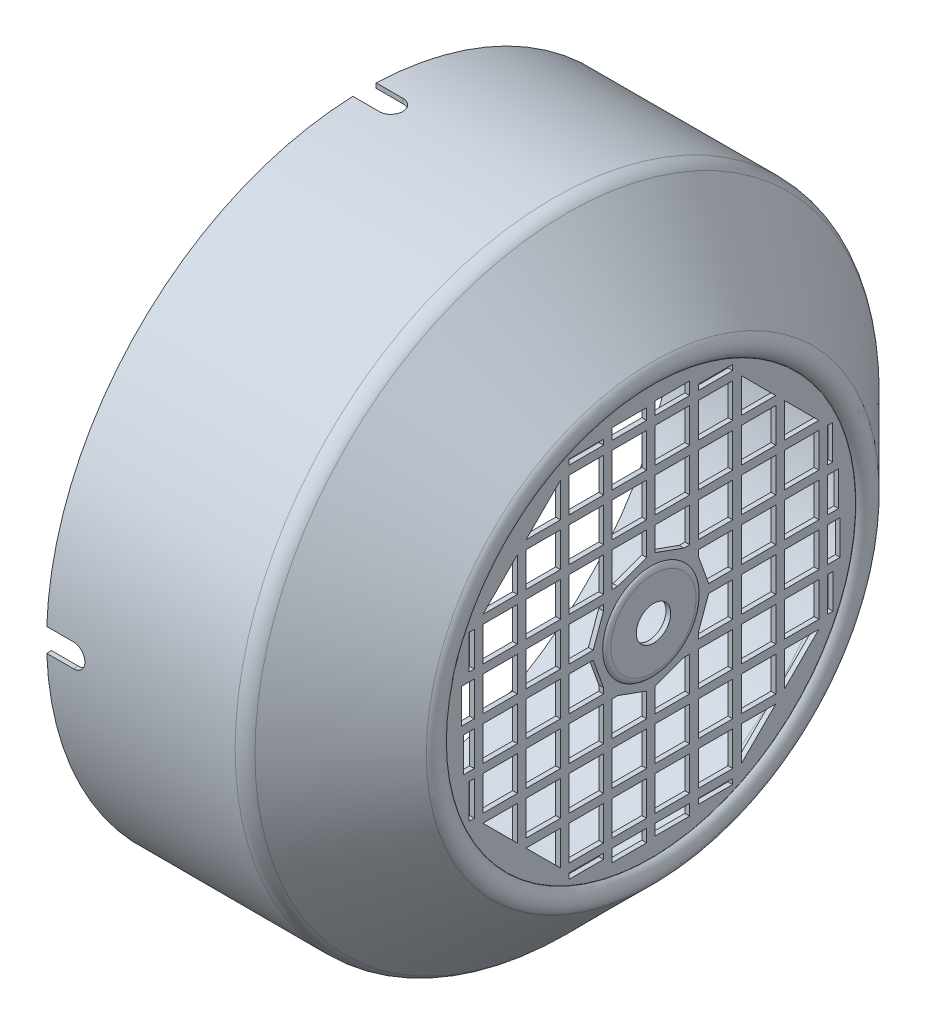
from build123d import *

# Parameters (mm, degrees)
ESQUISSE2_W                  = 8
ESQUISSE2_H                  = 8
ESQUISSE2_H_2                = 1.214320433
ESQUISSE2_H_3                = 2.566334159
ESQUISSE2_W_2                = 1.272320399
ESQUISSE2_W_3                = 2.946654197
ENL_V_MAT_EXTRU_1_DEPTH      = 124.778167703
R_P_TITION_CIRCULAIRE1_COUNT = 4
ENL_V_MAT_EXTRU_3_DEPTH      = 172.357441948
R_P_TITION_CIRCULAIRE6_COUNT = 3
R_P_TITION_CIRCULAIRE6_ANGLE = 180


with BuildPart() as part:
    # Esquisse1 → Révol.-Mince1 (revolve)
    with BuildSketch(Plane.XY, mode=Mode.PRIVATE) as r_vol_mince1_sk:
        with BuildLine():
            Line((0, 4), (0, 9.9))
            ThreePointArc((0, 9.9), (-0.175735931, 10.324264069), (-0.6, 10.5))
            Line((-0.6, 10.5), (-0.6, 47.5))
            ThreePointArc((-0.6, 47.5), (-0.469359346, 48.044491128), (-0.105882353, 48.470427794))
            ThreePointArc((-0.105882353, 48.470427794), (0.793266069, 50.077545561), (0.155634919, 51.805180336))
            Line((0.155634919, 51.805180336), (-19.73405848, 71.694873734))
            ThreePointArc((-19.73405848, 71.694873734), (-20.869540201, 72.453578364), (-22.208932214, 72.72))
            Line((-22.208932214, 72.72), (-66, 72.72))
            Line((-66, 72.72), (-66, 73.82))
            Line((-66, 73.82), (-22.208932214, 73.82))
            ThreePointArc((-22.208932214, 73.82), (-20.448588425, 73.46984585), (-18.956241021, 72.472691193))
            Line((-18.956241021, 72.472691193), (0.933452378, 52.582997795))
            ThreePointArc((0.933452378, 52.582997795), (1.889899103, 49.991545632), (0.541176471, 47.580868983))
            ThreePointArc((0.541176471, 47.580868983), (0.510886721, 47.545374261), (0.5, 47.5))
            Line((0.5, 47.5), (0.5, 11.19614814))
            ThreePointArc((0.5, 11.19614814), (0.942724862, 10.614142843), (1.1, 9.9))
            Line((1.1, 9.9), (1.1, 4))
            Line((1.1, 4), (0, 4))
        make_face()
    revolve(r_vol_mince1_sk.sketch.rotate(Axis((-18.547740113, 0, 0), (1, 0, 0)), 90), axis=Axis((-18.547740113, 0, 0), (1, 0, 0)))

    # Esquisse2 → Enlèv. mat.-Extru.1 (cut, through all)
    with BuildSketch(Plane(origin=(0.5, 0, 0), x_dir=(0, 0, -1), z_dir=(1, 0, 0))):
        with Locations((-5, 25)):
            Rectangle(ESQUISSE2_W, ESQUISSE2_H)
        with Locations((-15, 25)):
            Rectangle(ESQUISSE2_W, ESQUISSE2_H)
        Polygon((-1, 13.412417369), (-1, 19), (-9, 19), (-9, 11), (-7.724913145, 11), align=None)
        with Locations((-15, 15)):
            Rectangle(ESQUISSE2_W, ESQUISSE2_H)
        with Locations((-15, 41.607160217)):
            Rectangle(ESQUISSE2_W, ESQUISSE2_H_2)
        with Locations((-5, 42.28316708)):
            Rectangle(ESQUISSE2_W, ESQUISSE2_H_3)
        with Locations((-15, 35)):
            Rectangle(ESQUISSE2_W, ESQUISSE2_H)
        with Locations((-5, 35)):
            Rectangle(ESQUISSE2_W, ESQUISSE2_H)
        Polygon((-11, 9), (-11, 7.674091348), (-13.412417369, 1), (-19, 1), (-19, 9), align=None)
        with Locations((-25, 5)):
            Rectangle(ESQUISSE2_W, ESQUISSE2_H)
        Polygon((-21, 39), (-29, 31), (-21, 31), align=None)
        Polygon((-31, 29), (-39, 21), (-31, 21), align=None)
        with Locations((-41.636160199, 15)):
            Rectangle(ESQUISSE2_W_2, ESQUISSE2_H)
        with Locations((-42.473327099, 5)):
            Rectangle(ESQUISSE2_W_3, ESQUISSE2_H)
        with Locations((-25, 15)):
            Rectangle(ESQUISSE2_W, ESQUISSE2_H)
        with Locations((-35, 15)):
            Rectangle(ESQUISSE2_W, ESQUISSE2_H)
        with Locations((-25, 25)):
            Rectangle(ESQUISSE2_W, ESQUISSE2_H)
        with Locations((-35, 5)):
            Rectangle(ESQUISSE2_W, ESQUISSE2_H)
    enl_v_mat_extru_1 = extrude(amount=-ENL_V_MAT_EXTRU_1_DEPTH, mode=Mode.SUBTRACT)

    # Répétition circulaire1: Enlèv. mat.-Extru.1 ×4 about axis
    r_p_tition_circulaire1_axis = Axis((0, 0, 0), (1, 0, 0))
    for i in range(1, R_P_TITION_CIRCULAIRE1_COUNT):
        add(enl_v_mat_extru_1.rotate(r_p_tition_circulaire1_axis, i * 360 / R_P_TITION_CIRCULAIRE1_COUNT), mode=Mode.SUBTRACT)

    # Esquisse3 → Enlèv. mat.-Extru.3 (cut, symmetric)
    with BuildSketch(Plane(origin=(-44.104466107, 73.82, 0), x_dir=(0, 0, -1), z_dir=(0, 1, 0))):
        with BuildLine():
            Line((2.7, 236.499741216), (2.7, 21.895533893))
            Line((2.7, 21.895533893), (2.7, 15.695533893))
            ThreePointArc((2.7, 15.695533893), (0, 12.995533893), (-2.7, 15.695533893))
            Line((-2.7, 15.695533893), (-2.7, 21.895533893))
            Line((-2.7, 21.895533893), (-2.7, 236.499741216))
            Line((-2.7, 236.499741216), (-2.7, 665.708155862))
            Line((-2.7, 665.708155862), (2.7, 665.708155862))
            Line((2.7, 665.708155862), (2.7, 236.499741216))
        make_face()
    enl_v_mat_extru_3 = extrude(amount=ENL_V_MAT_EXTRU_3_DEPTH, both=True, mode=Mode.SUBTRACT)

    # Répétition circulaire6: Enlèv. mat.-Extru.3 ×3 about axis
    r_p_tition_circulaire6_axis = Axis((-18.547740113, 0, 0), (1, 0, 0))
    for i in range(1, R_P_TITION_CIRCULAIRE6_COUNT):
        add(enl_v_mat_extru_3.rotate(r_p_tition_circulaire6_axis, i * R_P_TITION_CIRCULAIRE6_ANGLE / (R_P_TITION_CIRCULAIRE6_COUNT - 1)), mode=Mode.SUBTRACT)


solid = part.part
